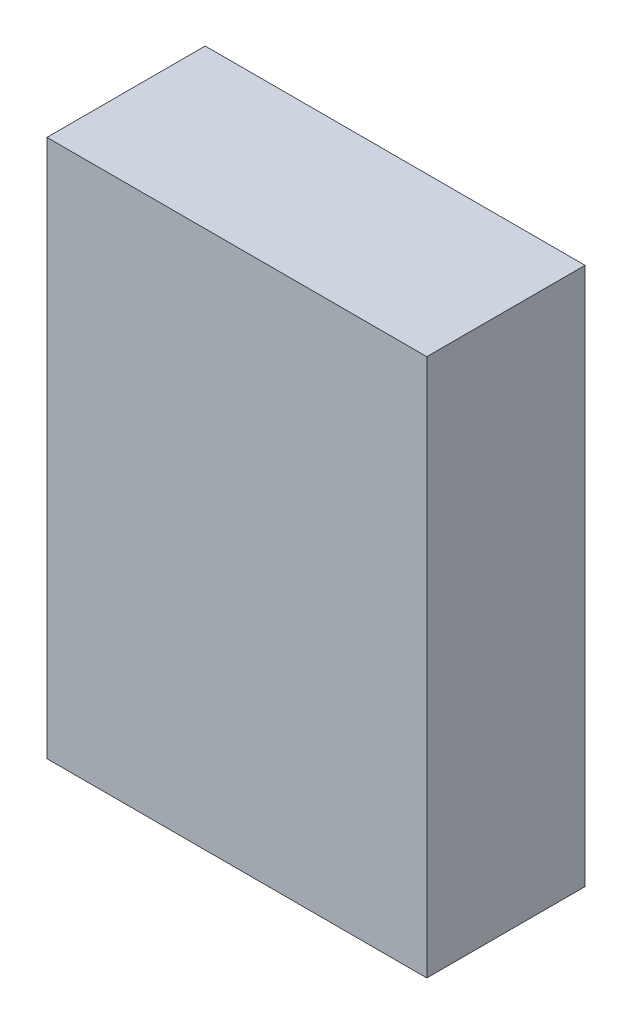
from build123d import *

# Parameters (mm, degrees)
SKETCH1_W           = 120
SKETCH1_H           = 170
BOSS_EXTRUDE1_DEPTH = 50


with BuildPart() as part:
    # Sketch1 → Boss-Extrude1 (new body)
    with BuildSketch(Plane.XY):
        Rectangle(SKETCH1_W, SKETCH1_H)
    extrude(amount=BOSS_EXTRUDE1_DEPTH)


solid = part.part
